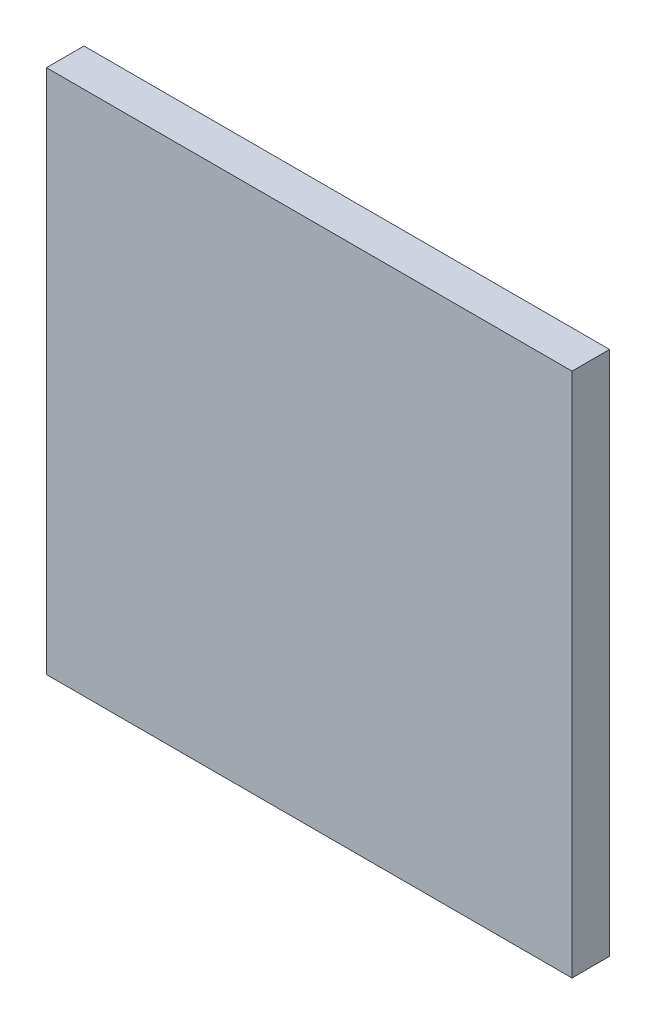
from build123d import *

# Parameters (mm, degrees)
SKETCH1_W           = 3.5
SKETCH1_H           = 3.5
BOSS_EXTRUDE1_DEPTH = 0.25


with BuildPart() as part:
    # Sketch1 → Boss-Extrude1 (new body)
    with BuildSketch(Plane.XY):
        Rectangle(SKETCH1_W, SKETCH1_H)
    extrude(amount=-BOSS_EXTRUDE1_DEPTH)


solid = part.part
